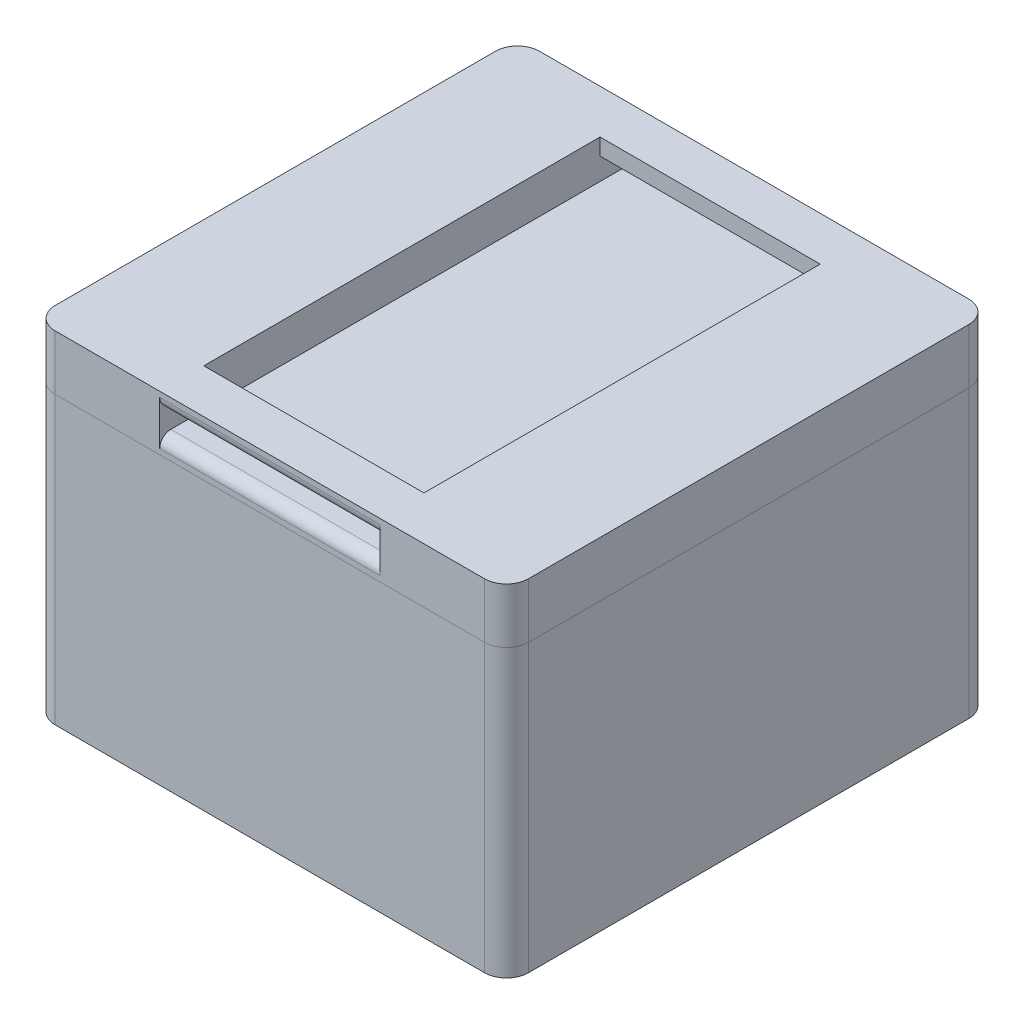
from build123d import *

# Parameters (mm, degrees)
BOSS_EXTRUDE1_DEPTH = 2
SKETCH2_W           = 18.8
SKETCH2_H           = 14.2
SKETCH2_W_2         = 15.1
SKETCH2_H_2         = 15.8
CUT_EXTRUDE1_DEPTH  = 1.4
SKETCH3_W           = 15.1
SKETCH3_H           = 10.3
CUT_EXTRUDE2_DEPTH  = 31.793018689
BOSS_EXTRUDE3_DEPTH = 24
SKETCH16_R          = 5.65
CUT_EXTRUDE6_DEPTH  = 19
BOSS_EXTRUDE4_DEPTH = 5
BOSS_EXTRUDE5_START = 3
SKETCH19_W          = 36
SKETCH19_H          = 37
BOSS_EXTRUDE5_DEPTH = 3
CUT_EXTRUDE7_START  = -44
SKETCH20_W          = 20
SKETCH20_H          = 2
CUT_EXTRUDE7_DEPTH  = 44
FILLET1_R           = 1
SKETCH21_W          = 20
SKETCH21_H          = 36
CUT_EXTRUDE8_DEPTH  = 1.5


with BuildPart() as part:
    # Sketch1 → Boss-Extrude1 (new body)
    with BuildSketch(Plane(origin=(0, 0, 0), x_dir=(1, 0, 0), z_dir=(0, 1, 0))):
        with BuildLine():
            Line((19.5, -22), (-19.5, -22))
            ThreePointArc((-19.5, -22), (-20.914213562, -21.414213562), (-21.5, -20))
            Line((-21.5, -20), (-21.5, 20))
            ThreePointArc((-21.5, 20), (-20.914213562, 21.414213562), (-19.5, 22))
            Line((-19.5, 22), (19.5, 22))
            ThreePointArc((19.5, 22), (20.914213562, 21.414213562), (21.5, 20))
            Line((21.5, 20), (21.5, -20))
            ThreePointArc((21.5, -20), (20.914213562, -21.414213562), (19.5, -22))
        make_face()
    extrude(amount=BOSS_EXTRUDE1_DEPTH)

    # Sketch2 → Cut-Extrude1 (cut)
    with BuildSketch(Plane(origin=(0, 2, 0), x_dir=(1, 0, 0), z_dir=(0, 1, 0))):
        with Locations((-8.4, -11.9)):
            Rectangle(SKETCH2_W, SKETCH2_H)
        with Locations((9.55, -11.1)):
            Rectangle(SKETCH2_W_2, SKETCH2_H_2)
    extrude(amount=-CUT_EXTRUDE1_DEPTH, mode=Mode.SUBTRACT)

    # Sketch3 → Cut-Extrude2 (cut, through all)
    with BuildSketch(Plane(origin=(0, 0.6, 0), x_dir=(1, 0, 0), z_dir=(0, 1, 0))):
        Polygon((-17.8, -6.8), (-15.8, -6.8), (-15.8, -4.8), (-1, -4.8), (-1, -6.8), (1, -6.8), (1, -18.5), (-17.8, -18.5), align=None)
        with Locations((9.55, -13.35)):
            Rectangle(SKETCH3_W, SKETCH3_H)
    extrude(amount=-CUT_EXTRUDE2_DEPTH, mode=Mode.SUBTRACT)

    # Sketch13 → Boss-Extrude3 (add)
    with BuildSketch(Plane(origin=(0, 2, 0), x_dir=(1, 0, 0), z_dir=(0, 1, 0))):
        with BuildLine():
            ThreePointArc((-21.5, -20), (-20.914213562, -21.414213562), (-19.5, -22))
            Line((-19.5, -22), (19.5, -22))
            ThreePointArc((19.5, -22), (20.914213562, -21.414213562), (21.5, -20))
            Line((21.5, -20), (21.5, 20))
            ThreePointArc((21.5, 20), (20.914213562, 21.414213562), (19.5, 22))
            Line((19.5, 22), (-19.5, 22))
            ThreePointArc((-19.5, 22), (-20.914213562, 21.414213562), (-21.5, 20))
            Line((-21.5, 20), (-21.5, -20))
        make_face()
        with BuildLine():
            ThreePointArc((19, 20.5), (19.707106781, 20.207106781), (20, 19.5))
            Line((20, 19.5), (20, -19.5))
            ThreePointArc((20, -19.5), (19.707106781, -20.207106781), (19, -20.5))
            Line((19, -20.5), (-19, -20.5))
            ThreePointArc((-19, -20.5), (-19.707106781, -20.207106781), (-20, -19.5))
            Line((-20, -19.5), (-20, 19.5))
            ThreePointArc((-20, 19.5), (-19.707106781, 20.207106781), (-19, 20.5))
            Line((-19, 20.5), (19, 20.5))
        make_face(mode=Mode.SUBTRACT)
    extrude(amount=BOSS_EXTRUDE3_DEPTH)

    # Sketch16 → Cut-Extrude6 (cut)
    with BuildSketch(Plane(origin=(-20, 0, 0), x_dir=(0, 0, -1), z_dir=(1, 0, 0))):
        with Locations((8.030344885, 12)):
            Circle(SKETCH16_R)
    extrude(amount=-CUT_EXTRUDE6_DEPTH, mode=Mode.SUBTRACT)


with BuildPart() as body_2:
    # Sketch17 → Boss-Extrude4 (new body)
    with BuildSketch(Plane(origin=(0, 26, 0), x_dir=(1, 0, 0), z_dir=(0, 1, 0))):
        with BuildLine():
            Line((21.5, -20), (21.5, 20))
            ThreePointArc((21.5, 20), (20.914213562, 21.414213562), (19.5, 22))
            Line((19.5, 22), (-19.5, 22))
            ThreePointArc((-19.5, 22), (-20.914213562, 21.414213562), (-21.5, 20))
            Line((-21.5, 20), (-21.5, -20))
            ThreePointArc((-21.5, -20), (-20.914213562, -21.414213562), (-19.5, -22))
            Line((-19.5, -22), (19.5, -22))
            ThreePointArc((19.5, -22), (20.914213562, -21.414213562), (21.5, -20))
        make_face()
    extrude(amount=BOSS_EXTRUDE4_DEPTH)

    # Sketch19 → Boss-Extrude5 (add)
    with BuildSketch(Plane.XZ.offset(-26).offset(BOSS_EXTRUDE5_START)):
        with BuildLine():
            Line((20, 19.5), (20, -19.5))
            ThreePointArc((20, -19.5), (19.707106781, -20.207106781), (19, -20.5))
            Line((19, -20.5), (-19, -20.5))
            ThreePointArc((-19, -20.5), (-19.707106781, -20.207106781), (-20, -19.5))
            Line((-20, -19.5), (-20, 19.5))
            ThreePointArc((-20, 19.5), (-19.707106781, 20.207106781), (-19, 20.5))
            Line((-19, 20.5), (19, 20.5))
            ThreePointArc((19, 20.5), (19.707106781, 20.207106781), (20, 19.5))
        make_face()
        Rectangle(SKETCH19_W, SKETCH19_H, mode=Mode.SUBTRACT)
    extrude(amount=-BOSS_EXTRUDE5_DEPTH)

    # Sketch20 → Cut-Extrude7 (cut)
    with BuildSketch(Plane.XY.offset(22).offset(CUT_EXTRUDE7_START)):
        with Locations((0, 28.5)):
            Rectangle(SKETCH20_W, SKETCH20_H)
    extrude(amount=CUT_EXTRUDE7_DEPTH, mode=Mode.SUBTRACT)

    # Fillet1
    fillet1_edges = [body_2.edges().sort_by_distance(p)[0] for p in [
        (0, 27.5, -22),
        (0, 29.5, -22),
        (0, 27.5, 22),
        (0, 29.5, 22),
    ]]
    fillet(fillet1_edges, radius=FILLET1_R)

    # Sketch21 → Cut-Extrude8 (cut)
    with BuildSketch(Plane.XZ.offset(-29.5)):
        Rectangle(SKETCH21_W, SKETCH21_H)
    extrude(amount=-CUT_EXTRUDE8_DEPTH, mode=Mode.SUBTRACT)


solid = Compound([part.part, body_2.part])
